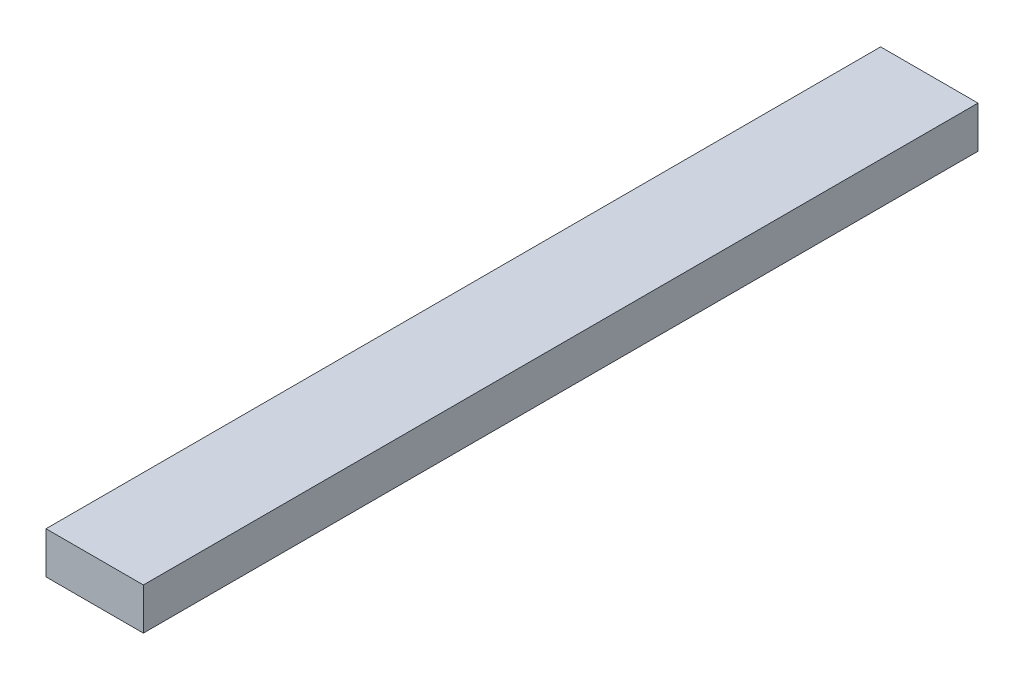
from build123d import *

# Parameters (mm, degrees)
SKETCH1_W           = 88.9
SKETCH1_H           = 38.1
BOSS_EXTRUDE1_DEPTH = 381


with BuildPart() as part:
    # Sketch1 → Boss-Extrude1 (new, symmetric)
    with BuildSketch(Plane.XY):
        Rectangle(SKETCH1_W, SKETCH1_H)
    extrude(amount=BOSS_EXTRUDE1_DEPTH, both=True)


solid = part.part
